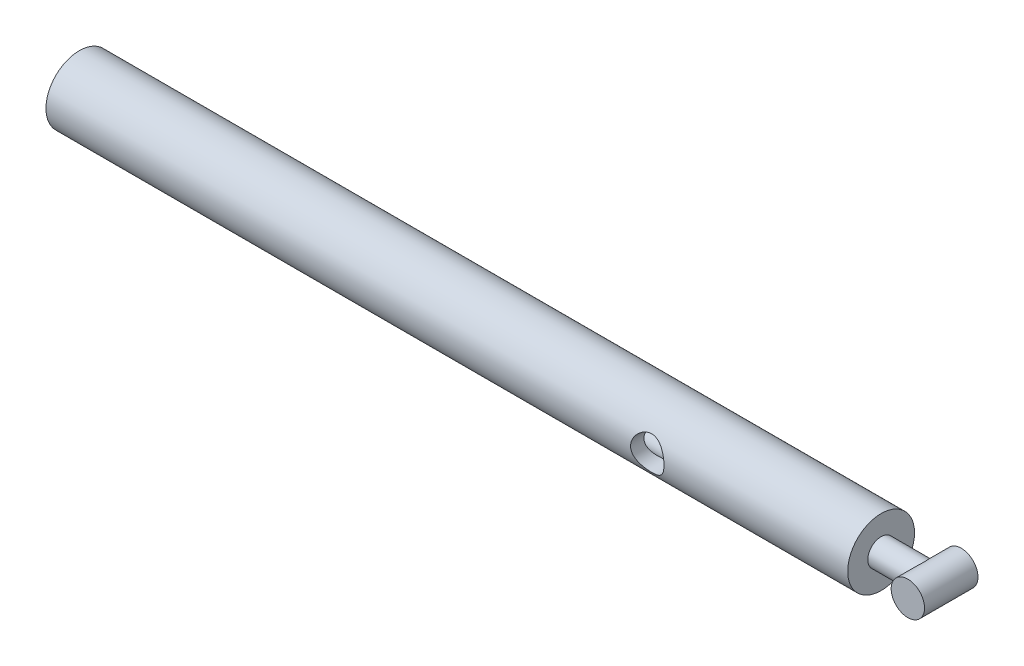
from build123d import *

# Parameters (mm, degrees)
SKETCH1_R                = 5
BOSS_EXTRUDE1_DEPTH      = 120
SKETCH2_R                = 2.5
CUT_EXTRUDE1_DEPTH       = 20
SKETCH3_R                = 3
CUT_EXTRUDE2_DEPTH       = 80
SKETCH4_R                = 2
BOSS_EXTRUDE2_DEPTH      = 8
BOSS_EXTRUDE3_DEPTH      = 4
BOSS_EXTRUDE3_DEPTH_BACK = 4
SKETCH5_R                = 2.5
CUT_EXTRUDE3_DEPTH       = 121.208152802
CUT_EXTRUDE3_DEPTH_BACK  = 121.208152802
SKETCH6_R                = 2.5


with BuildPart() as part:
    # Sketch1 → Boss-Extrude1 (new body)
    with BuildSketch(Plane(origin=(0, 0, 0), x_dir=(0, 0, -1), z_dir=(1, 0, 0))):
        Circle(SKETCH1_R)
    extrude(amount=-BOSS_EXTRUDE1_DEPTH)

    # Sketch2 → Cut-Extrude1 (cut)
    with BuildSketch(Plane.ZY.offset(120)):
        Circle(SKETCH2_R)
    extrude(amount=-CUT_EXTRUDE1_DEPTH, mode=Mode.SUBTRACT)

    # Sketch3 → Cut-Extrude2 (cut)
    with BuildSketch(Plane.ZY.offset(100)):
        Circle(SKETCH3_R)
    extrude(amount=-CUT_EXTRUDE2_DEPTH, mode=Mode.SUBTRACT)

    # Sketch4 → Boss-Extrude2 (add)
    with BuildSketch(Plane(origin=(0, 0, 0), x_dir=(0, 0, -1), z_dir=(1, 0, 0))):
        Circle(SKETCH4_R)
    extrude(amount=BOSS_EXTRUDE2_DEPTH)

    # Sketch5 → Boss-Extrude3 (add, two sides: drawn at the far end of the back side and taken through both)
    with BuildSketch(Plane.XY.offset(-BOSS_EXTRUDE3_DEPTH_BACK)):
        with Locations((8, 0)):
            Circle(SKETCH5_R)
    extrude(amount=BOSS_EXTRUDE3_DEPTH + BOSS_EXTRUDE3_DEPTH_BACK)

    # Sketch6 → Cut-Extrude3 (cut, two sides: drawn at the far end of the back side and taken through both)
    with BuildSketch(Plane.XY.offset(-CUT_EXTRUDE3_DEPTH_BACK)):
        with Locations((-30, 0)):
            Circle(SKETCH6_R)
    extrude(amount=CUT_EXTRUDE3_DEPTH + CUT_EXTRUDE3_DEPTH_BACK, mode=Mode.SUBTRACT)


solid = part.part
